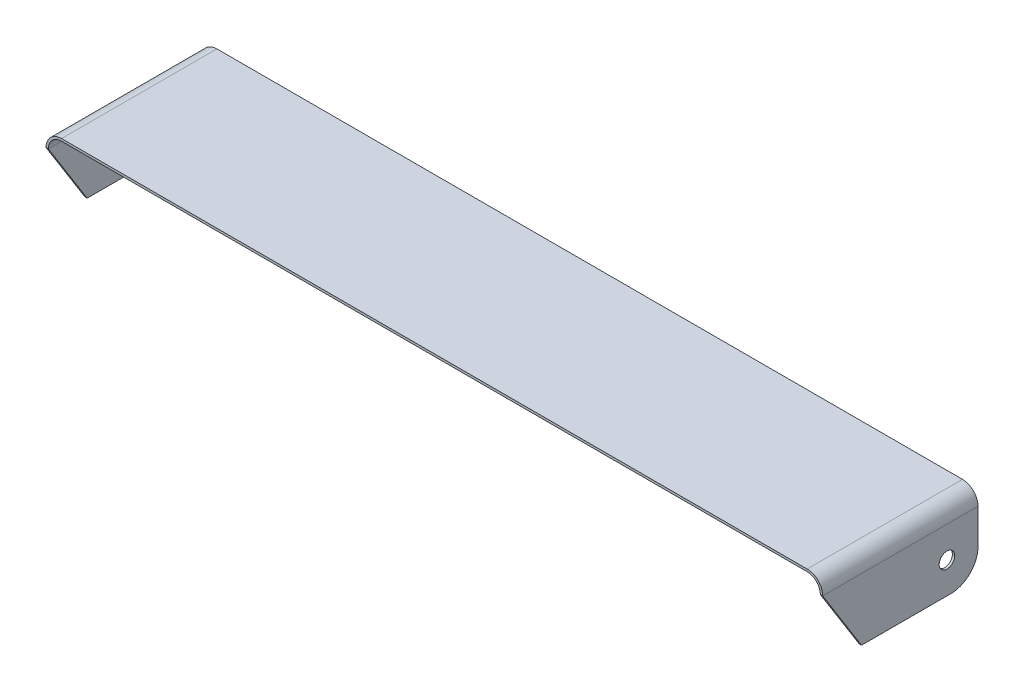
from build123d import *

# Parameters (mm, degrees)
BOSS_EXTRUDE1_DEPTH = 100
CUT_EXTRUDE1_DEPTH  = 1042.138560412
SKETCH3_R           = 10
CUT_EXTRUDE2_DEPTH  = 1042.138560412
FILLET1_R           = 35


with BuildPart() as part:
    # Sketch1 → Boss-Extrude1 (new, symmetric)
    with BuildSketch(Plane.XY):
        with BuildLine():
            Line((-500, 171.973347918), (-500, 251.973347918))
            ThreePointArc((-500, 251.973347918), (-494.142135624, 266.115483542), (-480, 271.973347918))
            Line((-480, 271.973347918), (480, 271.973347918))
            ThreePointArc((480, 271.973347918), (494.142135624, 266.115483542), (500, 251.973347918))
            Line((500, 251.973347918), (500, 171.973347918))
            Line((500, 171.973347918), (497, 171.973347918))
            Line((497, 171.973347918), (497, 251.973347918))
            ThreePointArc((497, 251.973347918), (492.02081528, 263.994163198), (480, 268.973347918))
            Line((480, 268.973347918), (-480, 268.973347918))
            ThreePointArc((-480, 268.973347918), (-492.02081528, 263.994163198), (-497, 251.973347918))
            Line((-497, 251.973347918), (-497, 171.973347918))
            Line((-497, 171.973347918), (-500, 171.973347918))
        make_face()
    extrude(amount=BOSS_EXTRUDE1_DEPTH, both=True)

    # Sketch2 → Cut-Extrude1 (cut, through all)
    with BuildSketch(Plane(origin=(500, 0, 0), x_dir=(0, 0, -1), z_dir=(1, 0, 0))):
        Polygon((-100, 171.973347918), (-50, 171.973347918), (-100, 251.973347918), align=None)
    extrude(amount=-CUT_EXTRUDE1_DEPTH, mode=Mode.SUBTRACT)

    # Sketch3 → Cut-Extrude2 (cut, through all)
    with BuildSketch(Plane(origin=(500, 0, 0), x_dir=(0, 0, -1), z_dir=(1, 0, 0))):
        with Locations(Location((60, 211.973347918, 0), (0, 0, 90))):
            Circle(SKETCH3_R)
    extrude(amount=-CUT_EXTRUDE2_DEPTH, mode=Mode.SUBTRACT)

    # Fillet1
    fillet1_edges = [part.edges().sort_by_distance(p)[0] for p in [
        (498.5, 171.973347918, -100),
        (-498.5, 171.973347918, -100),
    ]]
    fillet(fillet1_edges, radius=FILLET1_R)


solid = part.part
